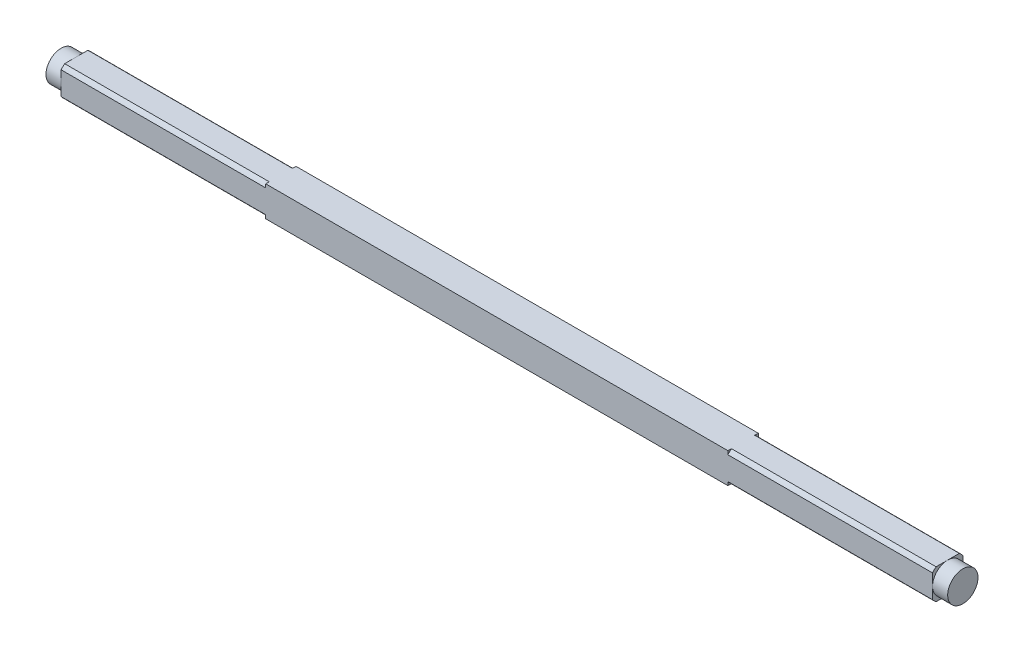
from build123d import *

# Parameters (mm, degrees)
SKETCH1_W           = 6.35
SKETCH1_H           = 6.35
BOSS_EXTRUDE1_DEPTH = 94.45625
SKETCH2_W           = 7.9375
SKETCH2_H           = 7.9375
SKETCH2_R           = 3.175
CUT_EXTRUDE1_DEPTH  = 3.175
CUT_EXTRUDE2_DEPTH  = 42.8625


with BuildPart() as part:
    # Sketch1 → Boss-Extrude1 (new body)
    with BuildSketch(Plane(origin=(0, 0, 0), x_dir=(0, 0, -1), z_dir=(1, 0, 0))):
        Rectangle(SKETCH1_W, SKETCH1_H)
    extrude(amount=BOSS_EXTRUDE1_DEPTH)

    # Sketch2 → Cut-Extrude1 (cut)
    with BuildSketch(Plane(origin=(94.45625, 0, 0), x_dir=(0, 0, -1), z_dir=(1, 0, 0))):
        Rectangle(SKETCH2_W, SKETCH2_H)
        Circle(SKETCH2_R, mode=Mode.SUBTRACT)
    extrude(amount=-CUT_EXTRUDE1_DEPTH, mode=Mode.SUBTRACT)

    # Sketch3 → Cut-Extrude2 (cut)
    with BuildSketch(Plane(origin=(91.28125, 0, 0), x_dir=(0, 0, -1), z_dir=(1, 0, 0))):
        with BuildLine():
            Line((-3.175, -2.432976572), (-3.175, -3.175))
            Line((-3.175, -3.175), (-2.432976572, -3.175))
            ThreePointArc((-2.432976572, -3.175), (-2.828427125, -2.828427125), (-3.175, -2.432976572))
        make_face()
        with BuildLine():
            Line((2.432976572, -3.175), (3.175, -3.175))
            Line((3.175, -3.175), (3.175, -2.432976572))
            ThreePointArc((3.175, -2.432976572), (2.828427125, -2.828427125), (2.432976572, -3.175))
        make_face()
        with BuildLine():
            Line((3.175, 2.432976572), (3.175, 3.175))
            Line((3.175, 3.175), (2.432976572, 3.175))
            ThreePointArc((2.432976572, 3.175), (2.828427125, 2.828427125), (3.175, 2.432976572))
        make_face()
        with BuildLine():
            Line((-3.175, 3.175), (-3.175, 2.432976572))
            ThreePointArc((-3.175, 2.432976572), (-2.828427125, 2.828427125), (-2.432976572, 3.175))
            Line((-2.432976572, 3.175), (-3.175, 3.175))
        make_face()
    extrude(amount=-CUT_EXTRUDE2_DEPTH, mode=Mode.SUBTRACT)

    # Mirror1: part across plane


with BuildPart() as part_1:
    add(part.part)
    add(part.part.mirror(Plane(origin=(0, 0, 0), x_dir=(0, 0, 1), z_dir=(1, 0, 0))))


solid = part_1.part
